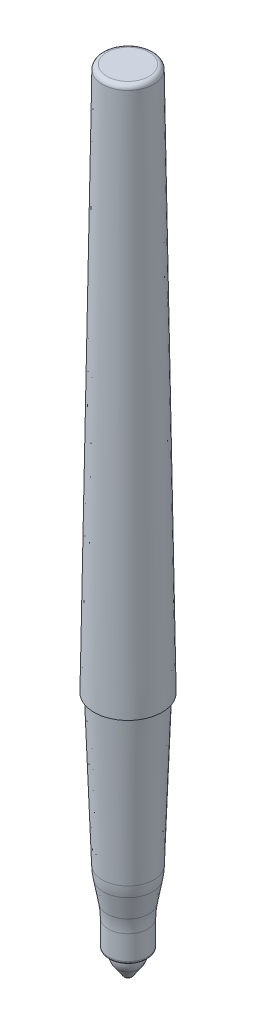
from build123d import *

# Parameters (mm, degrees)
FILLET1_R = 0.508
FILLET2_R = 2.54
FILLET3_R = 12.7
FILLET4_R = 0.508
FILLET5_R = 0.762


with BuildPart() as part:
    # Sketch1 → Revolve1 (revolve)
    with BuildSketch(Plane.XY, mode=Mode.PRIVATE) as revolve1_sk:
        Polygon((0, 0), (0.508, 0), (2.286, 2.54), (2.286, 3.81), (3.2131, 3.81), (3.2131, 9.398), (4.193012455, 14.859), (5.08, 40.259), (5.588, 40.259), (4.191, 129.54), (0, 129.54), align=None)
    revolve(revolve1_sk.sketch.rotate(Axis((0, 0, 0), (0, 1, 0)), 90), axis=Axis((0, 0, 0), (0, 1, 0)))

    # Fillet1
    fillet1_edges = [part.edges().sort_by_distance(p)[0] for p in [
        (0, 0, 0.508),
    ]]
    fillet(fillet1_edges, radius=FILLET1_R)

    # Fillet2
    fillet2_edges = [part.edges().sort_by_distance(p)[0] for p in [
        (0, 2.54, 2.286),
    ]]
    fillet(fillet2_edges, radius=FILLET2_R)

    # Fillet3
    fillet3_edges = [part.edges().sort_by_distance(p)[0] for p in [
        (0, 14.859, 4.193012455),
        (0, 9.398, 3.2131),
    ]]
    fillet(fillet3_edges, radius=FILLET3_R)

    # Fillet4
    fillet4_edges = [part.edges().sort_by_distance(p)[0] for p in [
        (0, 3.81, 3.2131),
    ]]
    fillet(fillet4_edges, radius=FILLET4_R)

    # Fillet5
    fillet5_edges = [part.edges().sort_by_distance(p)[0] for p in [
        (0, 129.54, 4.191),
    ]]
    fillet(fillet5_edges, radius=FILLET5_R)


solid = part.part
